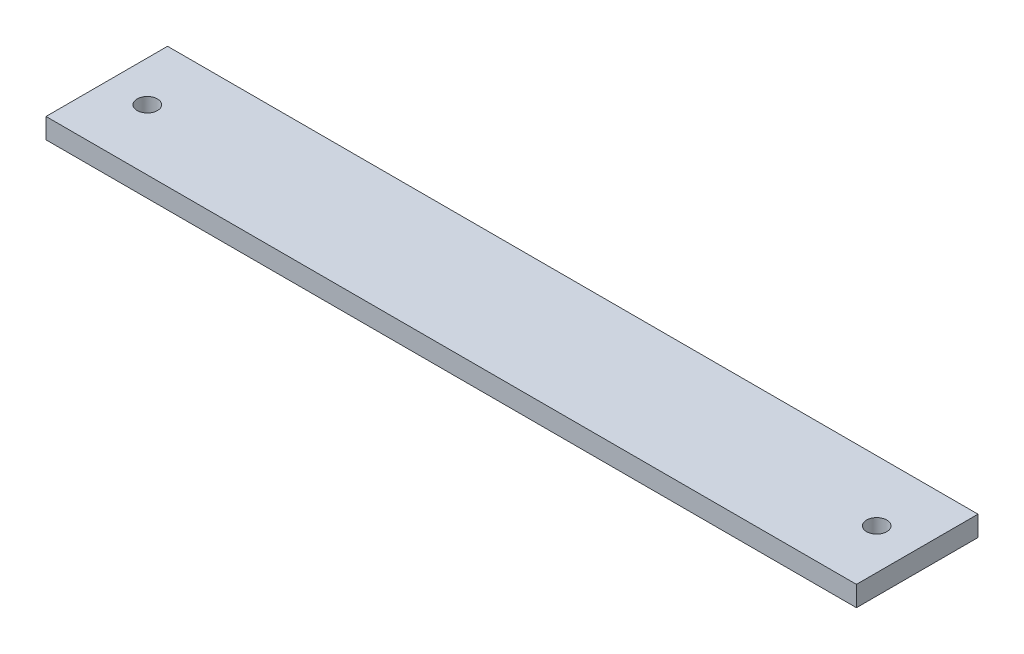
from build123d import *

# Parameters (mm, degrees)
SKETCH1_W           = 200
SKETCH1_H           = 30
SKETCH1_R           = 2.5
BOSS_EXTRUDE1_DEPTH = 5


with BuildPart() as part:
    # Sketch1 → Boss-Extrude1 (new body)
    with BuildSketch(Plane(origin=(0, 0, 0), x_dir=(1, 0, 0), z_dir=(0, 1, 0))):
        with Locations((86, -7.916666667)):
            Rectangle(SKETCH1_W, SKETCH1_H)
        with Locations(Location((176, -7.916666667, 0), (0, 0, 270))):
            Circle(SKETCH1_R, mode=Mode.SUBTRACT)
        with Locations(Location((-4, -7.916666667, 0), (0, 0, 90))):
            Circle(SKETCH1_R, mode=Mode.SUBTRACT)
    extrude(amount=BOSS_EXTRUDE1_DEPTH)


solid = part.part
